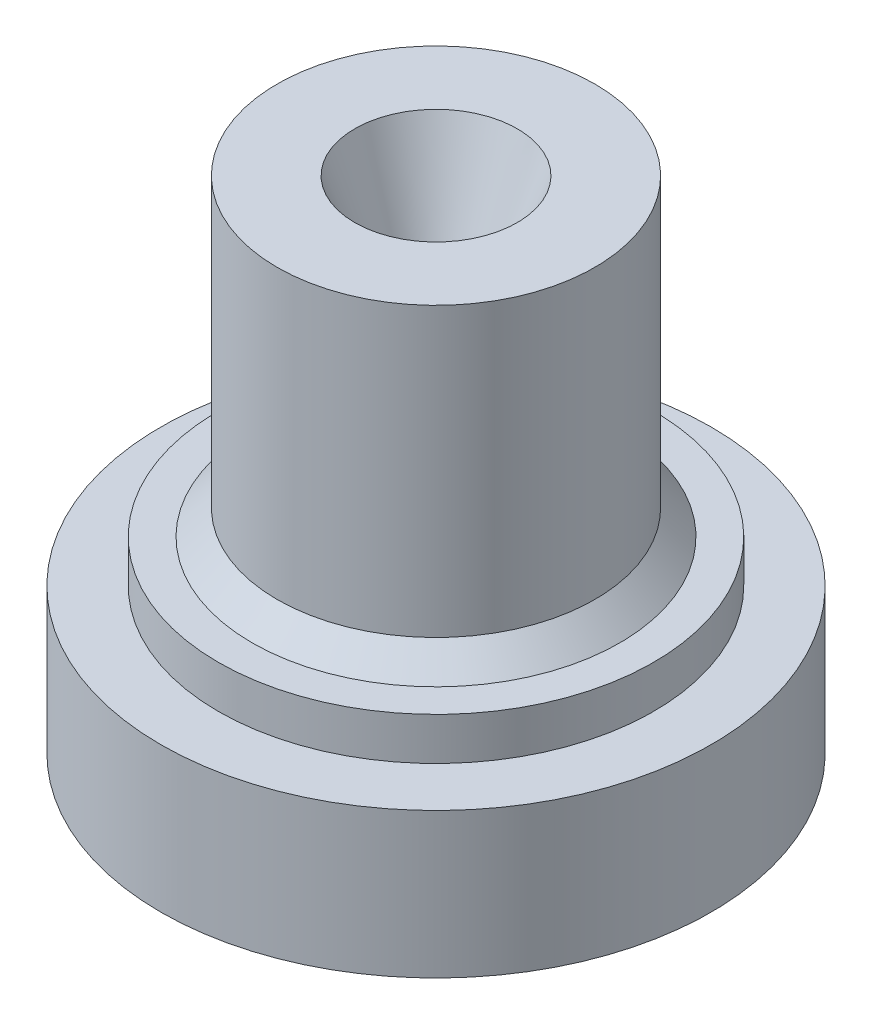
from build123d import *

# Parameters (mm, degrees)
SKETCH1_R           = 11
BOSS_EXTRUDE1_DEPTH = 5.8
SKETCH2_R           = 8.7
BOSS_EXTRUDE2_DEPTH = 1.7
SKETCH3_R           = 6.35
BOSS_EXTRUDE3_DEPTH = 12.5
CHAMFER1_SIZE       = 1
SKETCH4_R           = 1.25
CUT_EXTRUDE1_DEPTH  = 26.337718919
SKETCH5_R           = 3.25
CUT_EXTRUDE2_DEPTH  = 8
CUT_EXTRUDE2_DRAFT  = -20
SKETCH6_R           = 10
CUT_EXTRUDE3_DEPTH  = 9
CUT_EXTRUDE3_DRAFT  = -45


with BuildPart() as part:
    # Sketch1 → Boss-Extrude1 (new body)
    with BuildSketch(Plane(origin=(0, 0, 0), x_dir=(1, 0, 0), z_dir=(0, 1, 0))):
        with Locations(Location((0, 0, 0), (0, 0, 270))):
            Circle(SKETCH1_R)
    extrude(amount=BOSS_EXTRUDE1_DEPTH)

    # Sketch2 → Boss-Extrude2 (add)
    with BuildSketch(Plane(origin=(0, 5.8, 0), x_dir=(1, 0, 0), z_dir=(0, 1, 0))):
        with Locations(Location((0, 0, 0), (0, 0, 270))):
            Circle(SKETCH2_R)
    extrude(amount=BOSS_EXTRUDE2_DEPTH)

    # Sketch3 → Boss-Extrude3 (add)
    with BuildSketch(Plane(origin=(0, 7.5, 0), x_dir=(1, 0, 0), z_dir=(0, 1, 0))):
        with Locations(Location((0, 0, 0), (0, 0, 270))):
            Circle(SKETCH3_R)
    extrude(amount=BOSS_EXTRUDE3_DEPTH)

    # Chamfer1
    chamfer1_edges = [part.edges().sort_by_distance(p)[0] for p in [
        (0, 7.5, -6.35),
    ]]
    chamfer(chamfer1_edges, length=CHAMFER1_SIZE)

    # Sketch4 → Cut-Extrude1 (cut, through all)
    with BuildSketch(Plane(origin=(0, 20, 0), x_dir=(1, 0, 0), z_dir=(0, 1, 0))):
        with Locations(Location((0, 0, 0), (0, 0, 270))):
            Circle(SKETCH4_R)
    extrude(amount=-CUT_EXTRUDE1_DEPTH, mode=Mode.SUBTRACT)


with BuildPart() as cut_extrude2_tool:
    # Sketch5 → Cut-Extrude2 (with draft: the straight prism first)
    with BuildSketch(Plane(origin=(0, 20, 0), x_dir=(1, 0, 0), z_dir=(0, 1, 0))):
        Circle(SKETCH5_R)
    extrude(amount=-CUT_EXTRUDE2_DEPTH)
    # Cut-Extrude2: the draft: its side faces are tilted about the plane it starts from
    cut_extrude2_sides = [cut_extrude2_tool.faces().sort_by_distance(p)[0] for p in [
        (-3.25, 16, 0),
    ]]
    draft(cut_extrude2_sides, Plane(origin=(0, 20, 0), x_dir=(1, 0, 0), z_dir=(0, 1, 0)), CUT_EXTRUDE2_DRAFT)


with BuildPart() as part_1:
    add(part.part)

    # Cut-Extrude2: cut by cut_extrude2_tool
    add(cut_extrude2_tool.part, mode=Mode.SUBTRACT)


with BuildPart() as cut_extrude3_tool:
    # Sketch6 → Cut-Extrude3 (with draft: the straight prism first)
    with BuildSketch(Plane.XZ):
        Circle(SKETCH6_R)
    extrude(amount=-CUT_EXTRUDE3_DEPTH)
    # Cut-Extrude3: the draft: its side faces are tilted about the plane it starts from
    cut_extrude3_sides = [cut_extrude3_tool.faces().sort_by_distance(p)[0] for p in [
        (-10, 4.5, 0),
    ]]
    draft(cut_extrude3_sides, Plane.XZ, CUT_EXTRUDE3_DRAFT)


with BuildPart() as part_2:
    add(part_1.part)

    # Cut-Extrude3: cut by cut_extrude3_tool
    add(cut_extrude3_tool.part, mode=Mode.SUBTRACT)


solid = part_2.part
